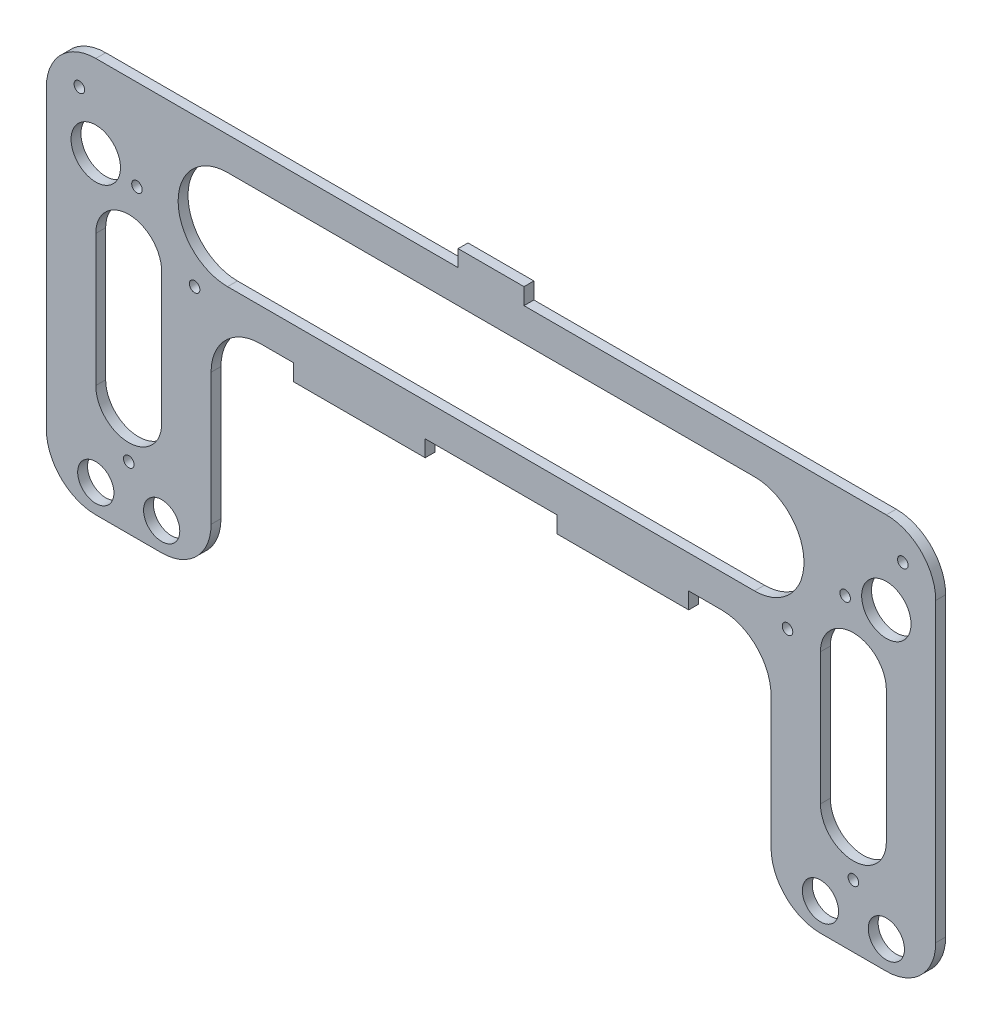
from build123d import *

# Parameters (mm, degrees)
SKETCH_1_R               = 5.5
EXTRUDE_1_DEPTH          = 1.5
CUT_EXTRUDE_1_DEPTH      = 166.102998156
CUT_EXTRUDE_1_DEPTH_BACK = 10
SKETCH_2_R               = 1.6
SKETCH_2_R_2             = 7.5


with BuildPart() as part:
    # 草图1 → 凸台-拉伸1 (new, symmetric)
    with BuildSketch(Plane.XY):
        with BuildLine():
            Line((-10, 25), (-120, 25))
            ThreePointArc((-120, 25), (-130.606601718, 20.606601718), (-135, 10))
            Line((-135, 10), (-135, -35))
            Line((-135, -35), (-135, -80))
            ThreePointArc((-135, -80), (-130.606601718, -90.606601718), (-120, -95))
            Line((-120, -95), (-110, -95))
            Line((-110, -95), (-100, -95))
            ThreePointArc((-100, -95), (-89.393398282, -90.606601718), (-85, -80))
            Line((-85, -80), (-85, -40))
            ThreePointArc((-85, -40), (-80.606601718, -29.393398282), (-70, -25))
            Line((-70, -25), (-60, -25))
            Line((-60, -25), (-60, -30))
            Line((-60, -30), (-45, -30))
            Line((-45, -30), (-20, -30))
            Line((-20, -30), (-20, -25))
            Line((-20, -25), (0, -25))
            Line((0, -25), (20, -25))
            Line((20, -25), (20, -30))
            Line((20, -30), (45, -30))
            Line((45, -30), (60, -30))
            Line((60, -30), (60, -25))
            Line((60, -25), (70, -25))
            ThreePointArc((70, -25), (80.606601718, -29.393398282), (85, -40))
            Line((85, -40), (85, -80))
            ThreePointArc((85, -80), (89.393398282, -90.606601718), (100, -95))
            Line((100, -95), (120, -95))
            ThreePointArc((120, -95), (130.606601718, -90.606601718), (135, -80))
            Line((135, -80), (135, -35))
            Line((135, -35), (135, 10))
            ThreePointArc((135, 10), (130.606601718, 20.606601718), (120, 25))
            Line((120, 25), (10, 25))
            Line((10, 25), (10, 30))
            Line((10, 30), (-10, 30))
            Line((-10, 30), (-10, 25))
        make_face()
        with Locations((-120, -86.5)):
            Circle(SKETCH_1_R, mode=Mode.SUBTRACT)
        with BuildLine():
            ThreePointArc((-94.5, -86.5), (-100, -92), (-105.5, -86.5))
            ThreePointArc((-105.5, -86.5), (-100, -81), (-94.5, -86.5))
        make_face(mode=Mode.SUBTRACT)
        with Locations((100, -86.5)):
            Circle(SKETCH_1_R, mode=Mode.SUBTRACT)
        with Locations((120, -86.5)):
            Circle(SKETCH_1_R, mode=Mode.SUBTRACT)
    extrude(amount=EXTRUDE_1_DEPTH, both=True)

    # 草图2 → 切除-拉伸1 (cut, two sides: drawn at the far end of the back side and taken through both)
    with BuildSketch(Plane.XY.offset(1.5).offset(-CUT_EXTRUDE_1_DEPTH_BACK)):
        with BuildLine():
            Line((80, 15), (-80, 15))
            ThreePointArc((-80, 15), (-95, 0), (-80, -15))
            Line((-80, -15), (80, -15))
            ThreePointArc((80, -15), (95, 0), (80, 15))
        make_face()
        with Locations(Location((-110, -76, 0), (0, 0, 180))):
            Circle(SKETCH_2_R)
        with BuildLine():
            ThreePointArc((-120, -61), (-117.071067812, -68.071067812), (-110, -71))
            ThreePointArc((-110, -71), (-102.928932188, -68.071067812), (-100, -61))
            Line((-100, -61), (-100, -21))
            ThreePointArc((-100, -21), (-110, -11), (-120, -21))
            Line((-120, -21), (-120, -61))
        make_face()
        with Locations(Location((-90, -20, 0), (0, 0, 180))):
            Circle(SKETCH_2_R)
        with BuildLine():
            ThreePointArc((120, -21), (110, -11), (100, -21))
            Line((100, -21), (100, -61))
            ThreePointArc((100, -61), (110, -71), (120, -61))
            Line((120, -61), (120, -21))
        make_face()
        with Locations(Location((-107.5, -2.5, 0), (0, 0, 180))):
            Circle(SKETCH_2_R)
        with Locations(Location((90, -20, 0), (0, 0, 180))):
            Circle(SKETCH_2_R)
        with Locations(Location((107.5, -2.5, 0), (0, 0, 180))):
            Circle(SKETCH_2_R)
        with Locations(Location((-125, 15, 0), (0, 0, 180))):
            Circle(SKETCH_2_R)
        with Locations(Location((-120, 0, 0), (0, 0, 180))):
            Circle(SKETCH_2_R_2)
        with Locations(Location((125, 15, 0), (0, 0, 180))):
            Circle(SKETCH_2_R)
        with Locations(Location((120, 0, 0), (0, 0, 180))):
            Circle(SKETCH_2_R_2)
        with Locations(Location((110, -76, 0), (0, 0, 180))):
            Circle(SKETCH_2_R)
    extrude(amount=CUT_EXTRUDE_1_DEPTH + CUT_EXTRUDE_1_DEPTH_BACK, mode=Mode.SUBTRACT)


solid = part.part
